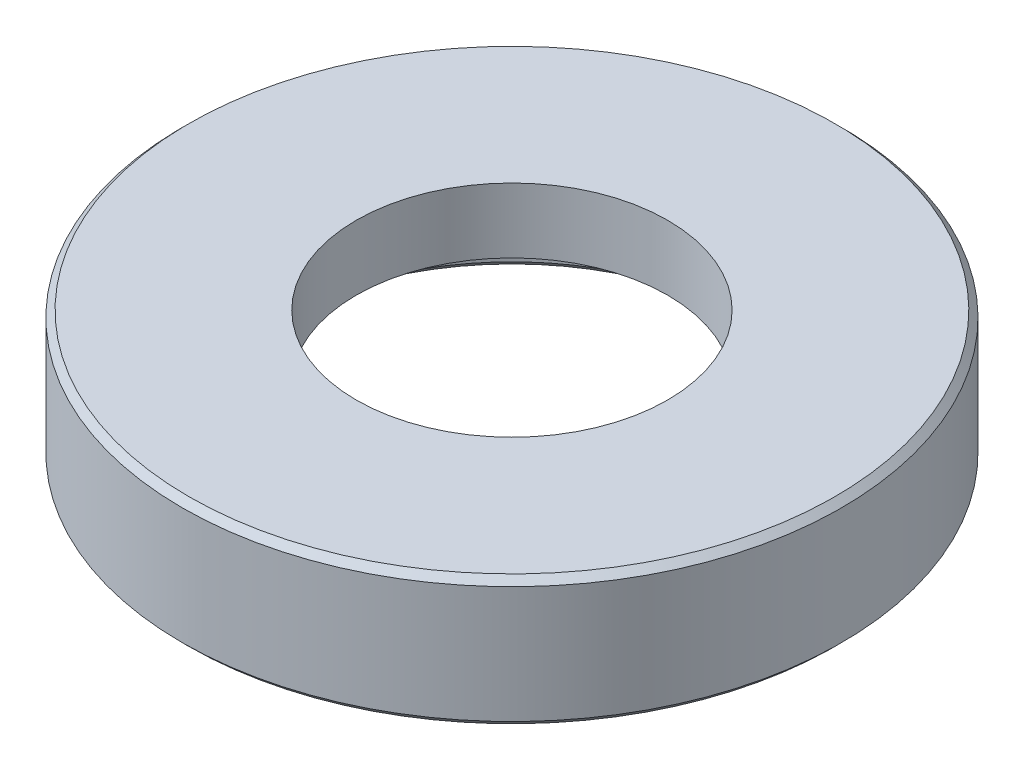
from build123d import *

# Parameters (mm, degrees)
SKETCH1_R           = 12.7
BOSS_EXTRUDE1_DEPTH = 5
SKETCH1_3_R         = 6
CUT_EXTRUDE1_DEPTH  = 5
SKETCH1_4_R         = 9
SKETCH1_4_R_2       = 6
CUT_EXTRUDE2_DEPTH  = 2.5
CHAMFER1_SIZE       = 0.25


with BuildPart() as part:
    # Sketch1 → Boss-Extrude1 (new body)
    with BuildSketch(Plane(origin=(0, 0, 0), x_dir=(1, 0, 0), z_dir=(0, 1, 0))):
        with Locations(Location((0, 0, 0), (0, 0, 270))):
            Circle(SKETCH1_R)
    extrude(amount=BOSS_EXTRUDE1_DEPTH)

    # Sketch1<3> → Cut-Extrude1 (cut)
    with BuildSketch(Plane(origin=(0, 0, 0), x_dir=(1, 0, 0), z_dir=(0, 1, 0))):
        with Locations(Location((0, 0, 0), (0, 0, 270))):
            Circle(SKETCH1_3_R)
    extrude(amount=CUT_EXTRUDE1_DEPTH, mode=Mode.SUBTRACT)

    # Sketch1<4> → Cut-Extrude2 (cut)
    with BuildSketch(Plane(origin=(0, 0, 0), x_dir=(1, 0, 0), z_dir=(0, 1, 0))):
        with Locations(Location((0, 0, 0), (0, 0, 270))):
            Circle(SKETCH1_4_R)
        with Locations(Location((0, 0, 0), (0, 0, 270))):
            Circle(SKETCH1_4_R_2, mode=Mode.SUBTRACT)
    extrude(amount=CUT_EXTRUDE2_DEPTH, mode=Mode.SUBTRACT)

    # Chamfer1
    chamfer1_edges = [part.edges().sort_by_distance(p)[0] for p in [
        (0, 0, -9),
        (0, 0, -12.7),
        (0, 5, -12.7),
    ]]
    chamfer(chamfer1_edges, length=CHAMFER1_SIZE)


solid = part.part
